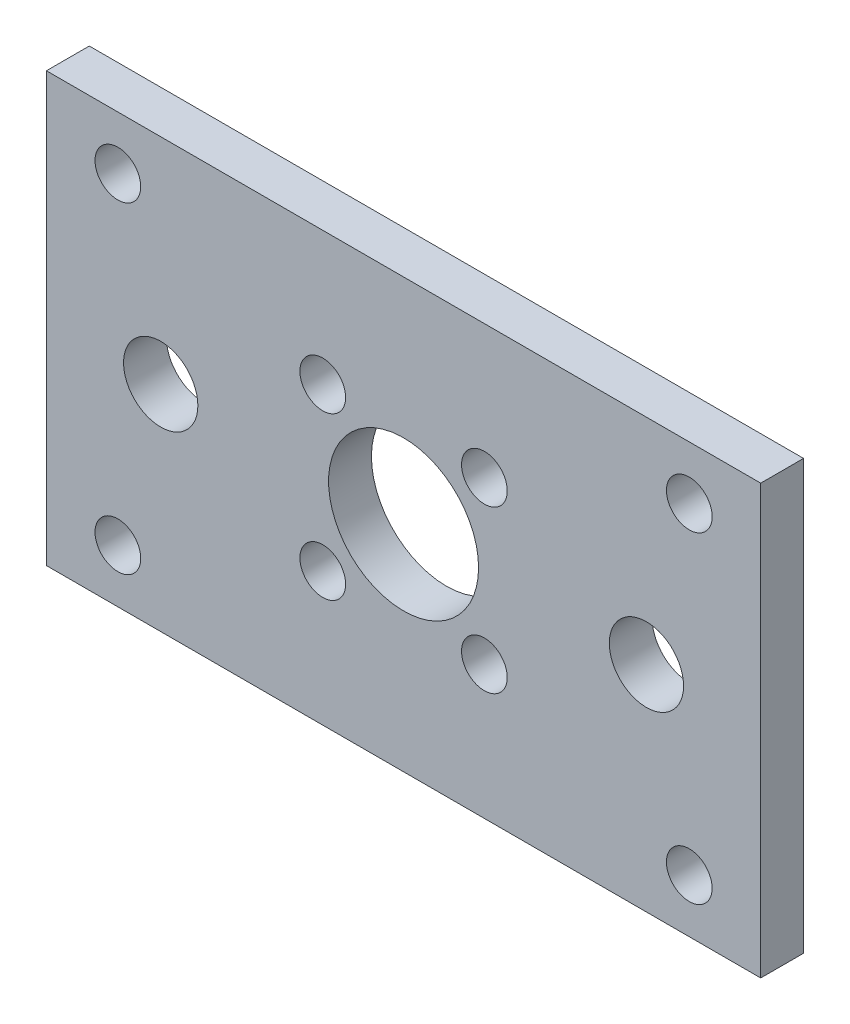
from build123d import *

# Parameters (mm, degrees)
SKETCH_1_W          = 50
SKETCH_1_H          = 30
EXTRUDE_1_DEPTH     = 3
SKETCH_2_R          = 2.6
SKETCH_2_R_2        = 1.6
SKETCH_2_R_3        = 5.25
CUT_EXTRUDE_1_DEPTH = 5


with BuildPart() as part:
    # 草图1 → 凸台-拉伸1 (new body)
    with BuildSketch(Plane.XY):
        with Locations((25, 15)):
            Rectangle(SKETCH_1_W, SKETCH_1_H)
    extrude(amount=EXTRUDE_1_DEPTH)

    # 草图2 → 切除-拉伸1 (cut)
    with BuildSketch(Plane.XY.offset(3)):
        with Locations((8, 15)):
            Circle(SKETCH_2_R)
        with Locations((42, 15)):
            Circle(SKETCH_2_R)
        with Locations((30.656854249, 20.656854249)):
            Circle(SKETCH_2_R_2)
        with Locations((30.656854249, 9.343145751)):
            Circle(SKETCH_2_R_2)
        with Locations((19.343145751, 9.343145751)):
            Circle(SKETCH_2_R_2)
        with Locations((19.343145751, 20.656854249)):
            Circle(SKETCH_2_R_2)
        with Locations((25, 15)):
            Circle(SKETCH_2_R_3)
        with Locations((45, 3.734603705)):
            Circle(SKETCH_2_R_2)
        with Locations(Location((45, 26.265396295, 0), (0, 0, 180))):
            Circle(SKETCH_2_R_2)
        with Locations((5, 26.265396295)):
            Circle(SKETCH_2_R_2)
        with Locations(Location((5, 3.734603705, 0), (0, 0, 180))):
            Circle(SKETCH_2_R_2)
    extrude(amount=-CUT_EXTRUDE_1_DEPTH, mode=Mode.SUBTRACT)


solid = part.part
